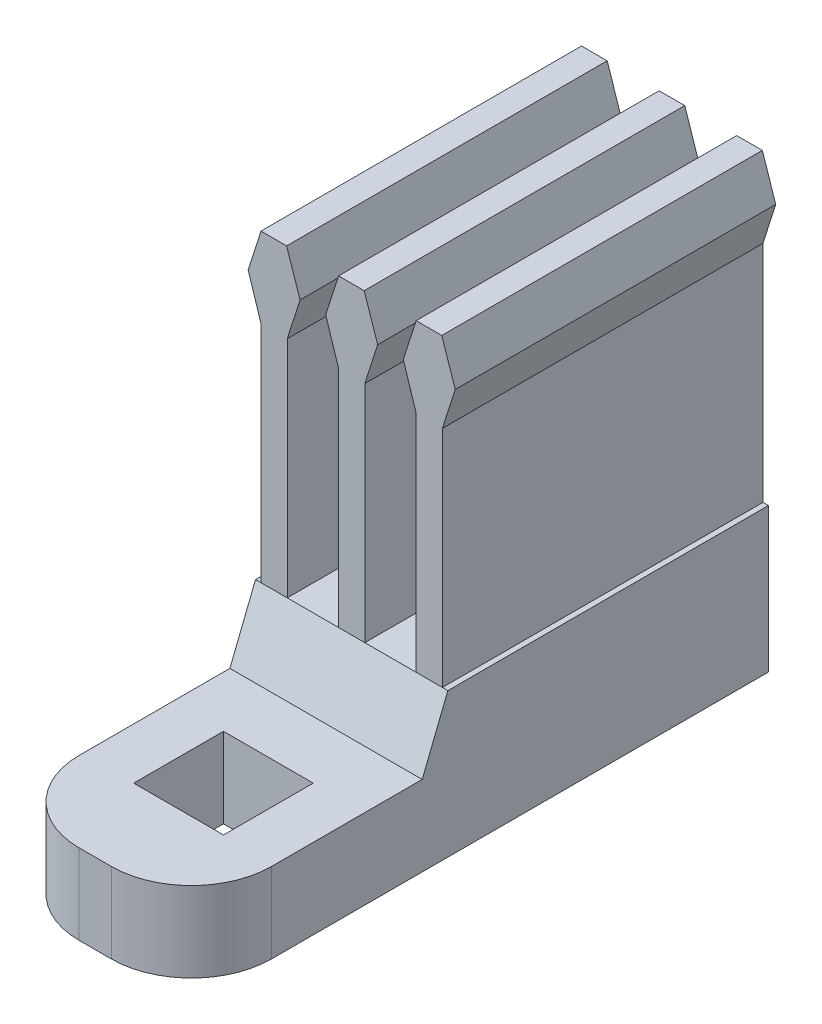
from build123d import *

# Parameters (mm, degrees)
RESSALTO_EXTRUS_O1_DEPTH   = 10
ESBO_O2_W                  = 6
ESBO_O2_H                  = 2.5
RESSALTO_EXTRUS_O2_DEPTH   = 8
ESBO_O3_W                  = 2.8
ESBO_O3_H                  = 2.8
CORTE_EXTRUS_O1_DEPTH      = 23.361475801
ESBO_O4_W                  = 6
ESBO_O4_H                  = 18
ESBO_O4_W_2                = 2.8
ESBO_O4_H_2                = 2.8
RESSALTO_EXTRUS_O3_DEPTH   = 2
CORTE_EXTRUS_O3_DEPTH      = 22.125472776
CORTE_EXTRUS_O3_DEPTH_BACK = 22.125472776
CORTE_EXTRUS_O4_DEPTH      = 23.097185341


with BuildPart() as part:
    # Esboço1 → Ressalto-extrusão1 (new body)
    with BuildSketch(Plane.XY):
        Polygon((-0.4, 0), (-0.57, 0), (-0.57, -2.5), (5.43, -2.5), (5.43, 0), (5.26, 0), (5.26, 7), (5.66, 8.25), (5.24, 9.5), (4.44, 9.5), (4.04, 8.25), (4.44, 7), (4.44, 0), (2.84, 0), (2.84, 7), (3.24, 8.25), (2.82, 9.5), (2.02, 9.5), (1.62, 8.25), (2.02, 7), (2.02, 0), (0.42, 0), (0.42, 7), (0.82, 8.25), (0.4, 9.5), (-0.4, 9.5), (-0.8, 8.25), (-0.4, 7), align=None)
    extrude(amount=RESSALTO_EXTRUS_O1_DEPTH)

    # Esboço2 → Ressalto-extrusão2 (add)
    with BuildSketch(Plane.XY.offset(10)):
        with Locations((2.43, -1.25)):
            Rectangle(ESBO_O2_W, ESBO_O2_H)
    extrude(amount=RESSALTO_EXTRUS_O2_DEPTH)

    # Esboço3 → Corte-extrusão1 (cut, through all)
    with BuildSketch(Plane.XZ.offset(2.5)):
        with Locations((2.43, 14)):
            Rectangle(ESBO_O3_W, ESBO_O3_H)
    extrude(amount=-CORTE_EXTRUS_O1_DEPTH, mode=Mode.SUBTRACT)

    # Esboço4 → Ressalto-extrusão3 (add)
    with BuildSketch(Plane.XZ.offset(2.5)):
        with Locations((2.43, 9)):
            Rectangle(ESBO_O4_W, ESBO_O4_H)
        with Locations((2.43, 14)):
            Rectangle(ESBO_O4_W_2, ESBO_O4_H_2, mode=Mode.SUBTRACT)
    extrude(amount=RESSALTO_EXTRUS_O3_DEPTH)

    # Esboço6 → Corte-extrusão3 (cut, two sides: drawn at the far end of the back side and taken through both)
    with BuildSketch(Plane(origin=(0, 0, 0), x_dir=(0, 0, -1), z_dir=(1, 0, 0)).offset(-CORTE_EXTRUS_O3_DEPTH_BACK)):
        Polygon((-18, 0), (-18, -2), (-14, -2), (-10.8, -2), (-10, 0), align=None)
    extrude(amount=CORTE_EXTRUS_O3_DEPTH + CORTE_EXTRUS_O3_DEPTH_BACK, mode=Mode.SUBTRACT)

    # Esboço7 → Corte-extrusão4 (cut, through all)
    with BuildSketch(Plane(origin=(0, -2, 0), x_dir=(1, 0, 0), z_dir=(0, 1, 0))):
        with BuildLine():
            Line((-0.57, -15.5), (-3.321312229, -15.5))
            Line((-3.321312229, -15.5), (-3.321312229, -18.857639181))
            Line((-3.321312229, -18.857639181), (8.546861735, -18.857639181))
            Line((8.546861735, -18.857639181), (8.546861735, -15.5))
            Line((8.546861735, -15.5), (5.43, -15.5))
            ThreePointArc((5.43, -15.5), (4.697766953, -17.267766953), (2.93, -18))
            Line((2.93, -18), (1.93, -18))
            ThreePointArc((1.93, -18), (0.162233047, -17.267766953), (-0.57, -15.5))
        make_face()
    extrude(amount=-CORTE_EXTRUS_O4_DEPTH, mode=Mode.SUBTRACT)


solid = part.part
